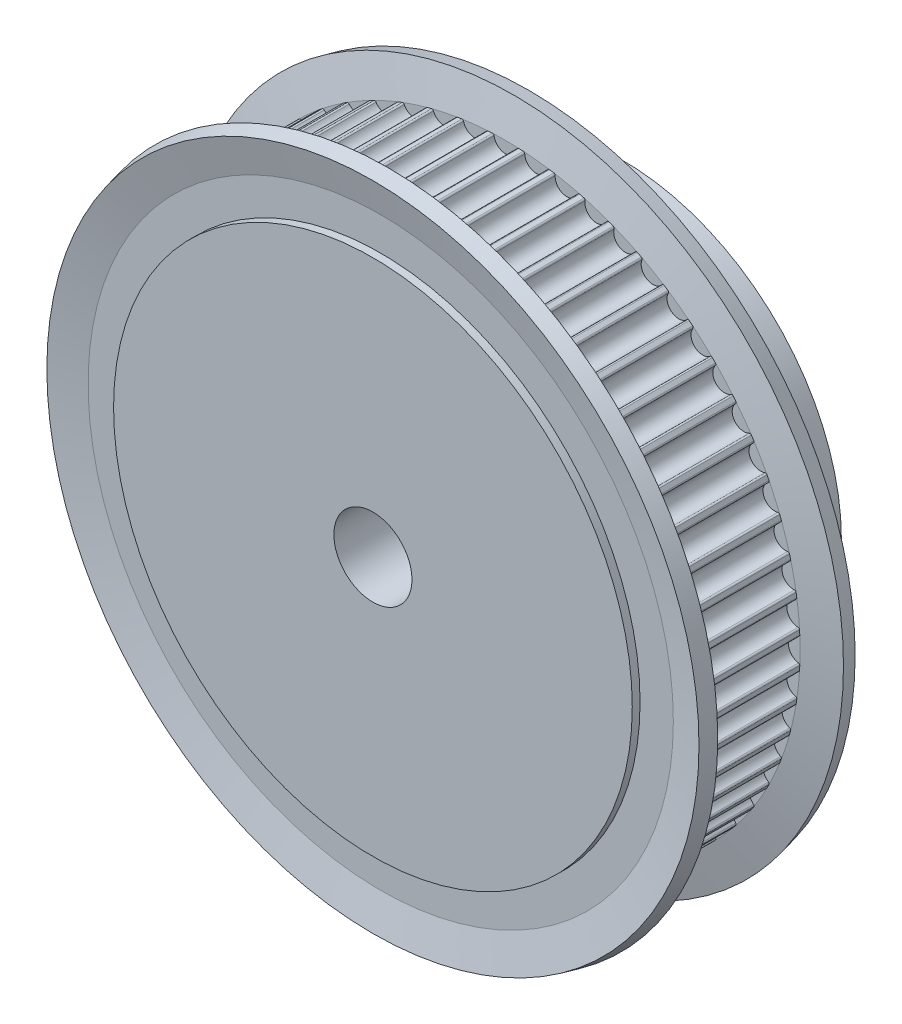
from build123d import *

# Parameters (mm, degrees)
SKETCH4_W          = 10
SKETCH4_H          = 14.108280255
SKETCH4_W_2        = 6
SKETCH4_H_2        = 11.5
SKETCH4_W_3        = 7
SKETCH4_H_3        = 2.246
CUT_EXTRUDE3_DEPTH = 3.5
CIRPATTERN2_COUNT  = 60
SKETCH7_W          = 1.25
SKETCH7_H          = 21.108280255
CIRPATTERN3_COUNT  = 2
CIRPATTERN3_ANGLE  = 120


with BuildPart() as part:
    # Sketch4 → Revolve1 (revolve)
    with BuildSketch(Plane(origin=(0, 0, 0), x_dir=(0, 0, -1), z_dir=(1, 0, 0)), mode=Mode.PRIVATE) as revolve1_sk:
        with Locations((0, 9.554140128)):
            Rectangle(SKETCH4_W, SKETCH4_H)
        with Locations((8, 8.25)):
            Rectangle(SKETCH4_W_2, SKETCH4_H_2)
        with Locations((0, 17.731280255)):
            Rectangle(SKETCH4_W_3, SKETCH4_H_3)
        Polygon((-4.5, 18.739106601), (-4.5, 16.608280255), (-3.5, 16.608280255), (-3.5, 18.854280255), (-4.026182629, 21.108280255), (-5, 20.880948496), align=None)
        Polygon((3.5, 18.854280255), (3.5, 16.608280255), (4.5, 16.608280255), (4.5, 18.739106601), (5, 20.880948496), (4.026182629, 21.108280255), align=None)
    revolve(revolve1_sk.sketch.rotate(Axis((0, 0, 5.15), (0, 0, -1)), 90), axis=Axis((0, 0, 5.15), (0, 0, -1)))

    # Sketch1 → Cut-Extrude3 (cut, symmetric)
    with BuildSketch(Plane.XY):
        with BuildLine():
            ThreePointArc((0.742122895, 18.749866192), (0.777385198, 18.81250776), (0.845557311, 18.835310371))
            ThreePointArc((0.845557311, 18.835310371), (0, 18.854280255), (-0.845557311, 18.835310371))
            ThreePointArc((-0.845557311, 18.835310371), (-0.777385198, 18.81250776), (-0.742122895, 18.749866192))
            ThreePointArc((-0.742122895, 18.749866192), (0, 18.108280255), (0.742122895, 18.749866192))
        make_face()
    cut_extrude3 = extrude(amount=CUT_EXTRUDE3_DEPTH, both=True, mode=Mode.SUBTRACT)

    # CirPattern2: Cut-Extrude3 ×60 about axis
    cirpattern2_axis = Axis((0, 0, 0), (0, 0, 1))
    for i in range(1, CIRPATTERN2_COUNT):
        add(cut_extrude3.rotate(cirpattern2_axis, i * 360 / CIRPATTERN2_COUNT), mode=Mode.SUBTRACT)

    # Sketch7 → M3 Tapped Hole1 (revolve, cut)
    with BuildSketch(Plane(origin=(0, 0, -7), x_dir=(0, 0, -1), z_dir=(1, 0, 0))):
        with Locations((0.625, 10.554140128)):
            Rectangle(SKETCH7_W, SKETCH7_H)
    m3_tapped_hole1 = revolve(axis=Axis((0, -6.35, -7), (0, 1, 0)), mode=Mode.SUBTRACT)

    # CirPattern3: M3 Tapped Hole1 ×2 about axis
    cirpattern3_axis = Axis((0, 0, 5.15), (0, 0, 1))
    for i in range(1, CIRPATTERN3_COUNT):
        add(m3_tapped_hole1.rotate(cirpattern3_axis, i * CIRPATTERN3_ANGLE / (CIRPATTERN3_COUNT - 1)), mode=Mode.SUBTRACT)


solid = part.part
